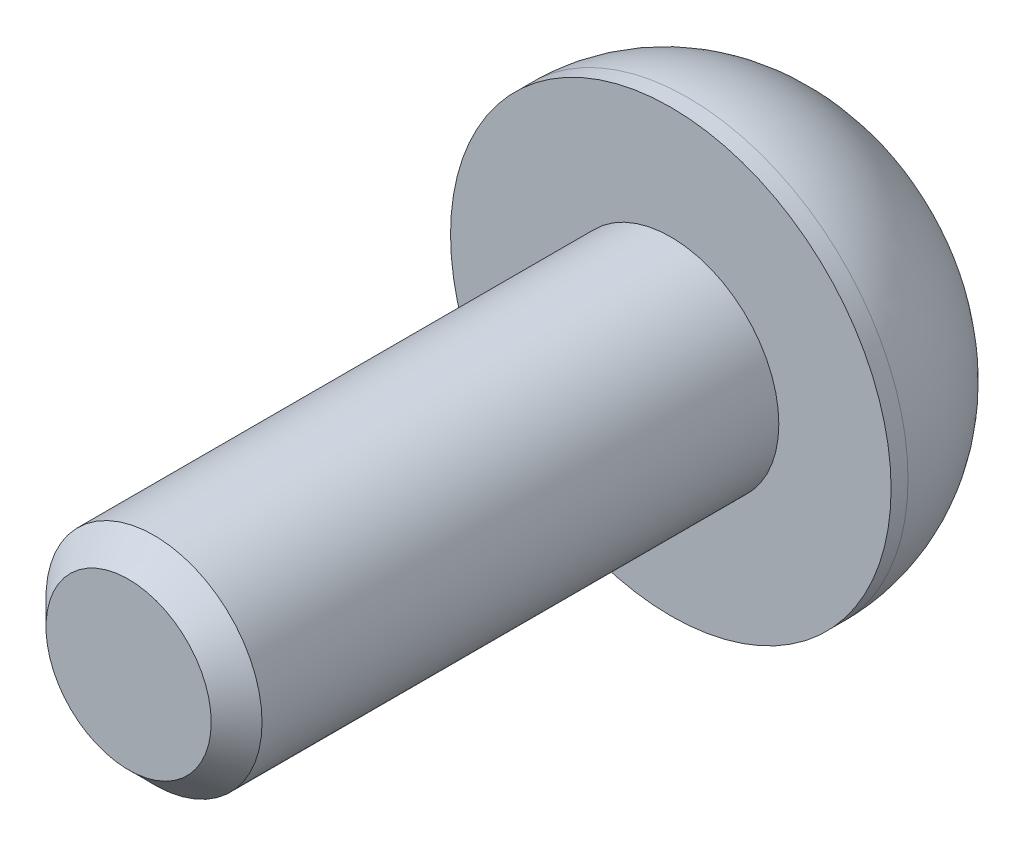
from build123d import *

# Parameters (mm, degrees)
SKICA1_R                 = 2.6
P_IDAT_VYSUNUT_M1_DEPTH  = 2.2
SKICA2_R                 = 1.275
P_IDAT_VYSUNUT_M2_DEPTH  = 6.4
ZAOBLIT1_R               = 2
ODEBRAT_VYSUNUT_M1_DEPTH = 0.7
ZKOSEN_1_SIZE            = 0.3


with BuildPart() as part:
    # Skica1 → Přidat vysunutím1 (new body)
    with BuildSketch(Plane.XY):
        Circle(SKICA1_R)
    extrude(amount=P_IDAT_VYSUNUT_M1_DEPTH)

    # Skica2 → Přidat vysunutím2 (add)
    with BuildSketch(Plane.XY.offset(2.2)):
        Circle(SKICA2_R)
    extrude(amount=P_IDAT_VYSUNUT_M2_DEPTH)

    # Zaoblit1
    zaoblit1_edges = [part.edges().sort_by_distance(p)[0] for p in [
        (-2.6, 0, 0),
    ]]
    fillet(zaoblit1_edges, radius=ZAOBLIT1_R)

    # Skica3 → Odebrat vysunutím1 (cut)
    with BuildSketch(Plane(origin=(0, 0, 0), x_dir=(-1, 0, 0), z_dir=(0, 0, -1))):
        Polygon((-1.65, 0), (-1.65, 0.25), (-0.25, 0.25), (-0.25, 1.65), (0.25, 1.65), (0.25, 0.25), (1.65, 0.25), (1.65, -0.25), (0.25, -0.25), (0.25, -1.65), (-0.25, -1.65), (-0.25, -0.25), (-1.65, -0.25), align=None)
    extrude(amount=-ODEBRAT_VYSUNUT_M1_DEPTH, mode=Mode.SUBTRACT)

    # Zkosení1
    zkosen_1_edges = [part.edges().sort_by_distance(p)[0] for p in [
        (-1.275, 0, 8.6),
    ]]
    chamfer(zkosen_1_edges, length=ZKOSEN_1_SIZE)


solid = part.part
